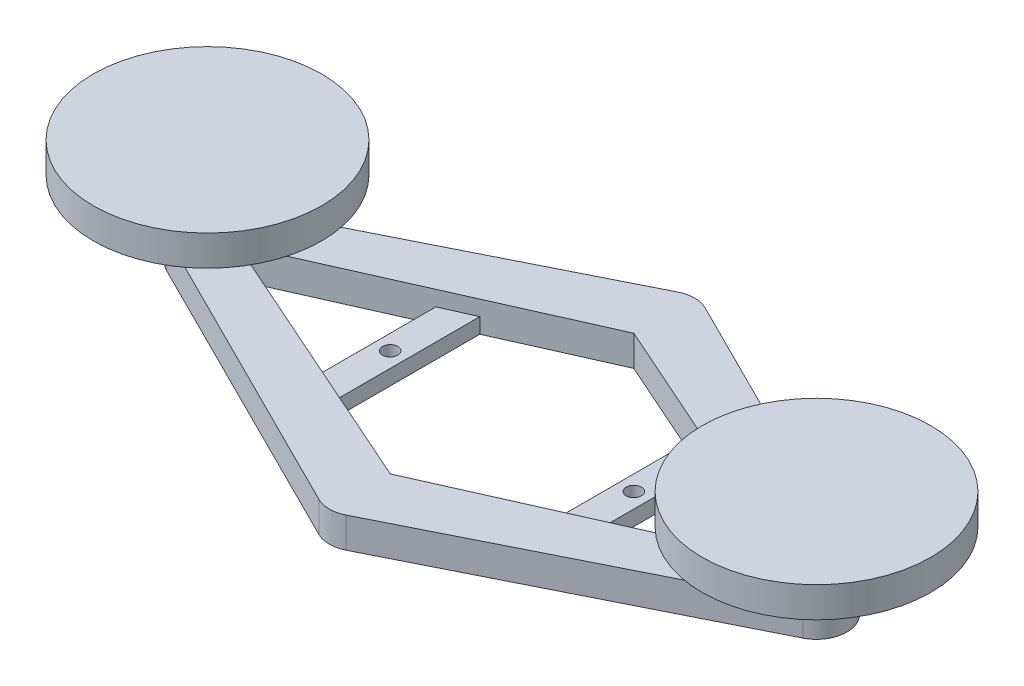
from build123d import *

# Parameters (mm, degrees)
SKETCH5_R             = 1.27
BOSS_EXTRUDE2_DEPTH   = 2.54
BOSS_EXTRUDE2_2_DEPTH = 2.54
BOSS_EXTRUDE1_DEPTH   = 5.08
SKETCH6_R             = 3.175
BOSS_EXTRUDE3_DEPTH   = 7.62
SKETCH11_R            = 19.05
BOSS_EXTRUDE4_DEPTH   = 5.08
SKETCH13_R            = 19.05
BOSS_EXTRUDE5_DEPTH   = 5.08


with BuildPart() as part:
    # Sketch5 → Boss-Extrude2 (new body)
    with BuildSketch(Plane(origin=(0, 0, 0), x_dir=(1, 0, 0), z_dir=(0, 1, 0))):
        Polygon((-22.86, 10.16), (-22.86, -10.16), (-17.78, -12.417777778), (-17.78, 12.417777778), align=None)
        with Locations(Location((-20.32, 0, 0), (0, 0, 270))):
            Circle(SKETCH5_R, mode=Mode.SUBTRACT)
    extrude(amount=BOSS_EXTRUDE2_DEPTH)



with BuildPart() as body_2:
    # Sketch5 → Boss-Extrude2 2 (new body)
    with BuildSketch(Plane(origin=(0, 0, 0), x_dir=(1, 0, 0), z_dir=(0, 1, 0))):
        Polygon((22.86, 10.16), (17.78, 12.417777778), (17.78, -12.417777778), (22.86, -10.16), align=None)
        with Locations(Location((20.32, 0, 0), (0, 0, 90))):
            Circle(SKETCH5_R, mode=Mode.SUBTRACT)
    extrude(amount=BOSS_EXTRUDE2_2_DEPTH)


with BuildPart() as part_1:
    add(part.part)

    add(body_2.part)  # Boss-Extrude1 merges body 2
    # Sketch2 → Boss-Extrude1 (add)
    with BuildSketch(Plane(origin=(0, 0, 0), x_dir=(1, 0, 0), z_dir=(0, 1, 0))):
        with BuildLine():
            Line((-53.071845065, -4.54369013), (-2.271845065, -29.94369013))
            ThreePointArc((-2.271845065, -29.94369013), (0, -30.48), (2.271845065, -29.94369013))
            Line((2.271845065, -29.94369013), (53.071845065, -4.54369013))
            ThreePointArc((53.071845065, -4.54369013), (55.88, 0), (53.071845065, 4.54369013))
            Line((53.071845065, 4.54369013), (2.271845065, 29.94369013))
            ThreePointArc((2.271845065, 29.94369013), (0, 30.48), (-2.271845065, 29.94369013))
            Line((-2.271845065, 29.94369013), (-53.071845065, 4.54369013))
            ThreePointArc((-53.071845065, 4.54369013), (-55.88, 0), (-53.071845065, -4.54369013))
        make_face()
        Polygon((-45.72, 0), (0, 20.32), (45.72, 0), (0, -20.32), align=None, mode=Mode.SUBTRACT)
    extrude(amount=BOSS_EXTRUDE1_DEPTH)

    # Sketch6 → Boss-Extrude3 (add)
    with BuildSketch(Plane(origin=(0, 5.08, 0), x_dir=(1, 0, 0), z_dir=(0, 1, 0))):
        with Locations(Location((-50.8, 0, 0), (0, 0, 90))):
            Circle(SKETCH6_R)
        with Locations(Location((50.8, 0, 0), (0, 0, 90))):
            Circle(SKETCH6_R)
    extrude(amount=BOSS_EXTRUDE3_DEPTH)

    # Sketch11 → Boss-Extrude4 (add)
    with BuildSketch(Plane(origin=(0, 12.7, 0), x_dir=(1, 0, 0), z_dir=(0, 1, 0))):
        with Locations(Location((-50.8, 0, 0), (0, 0, 270))):
            Circle(SKETCH11_R)
    extrude(amount=BOSS_EXTRUDE4_DEPTH)

    # Sketch13 → Boss-Extrude5 (add)
    with BuildSketch(Plane(origin=(0, 12.7, 0), x_dir=(1, 0, 0), z_dir=(0, 1, 0))):
        with Locations(Location((50.8, 0, 0), (0, 0, 270))):
            Circle(SKETCH13_R)
    extrude(amount=BOSS_EXTRUDE5_DEPTH)


solid = part_1.part
